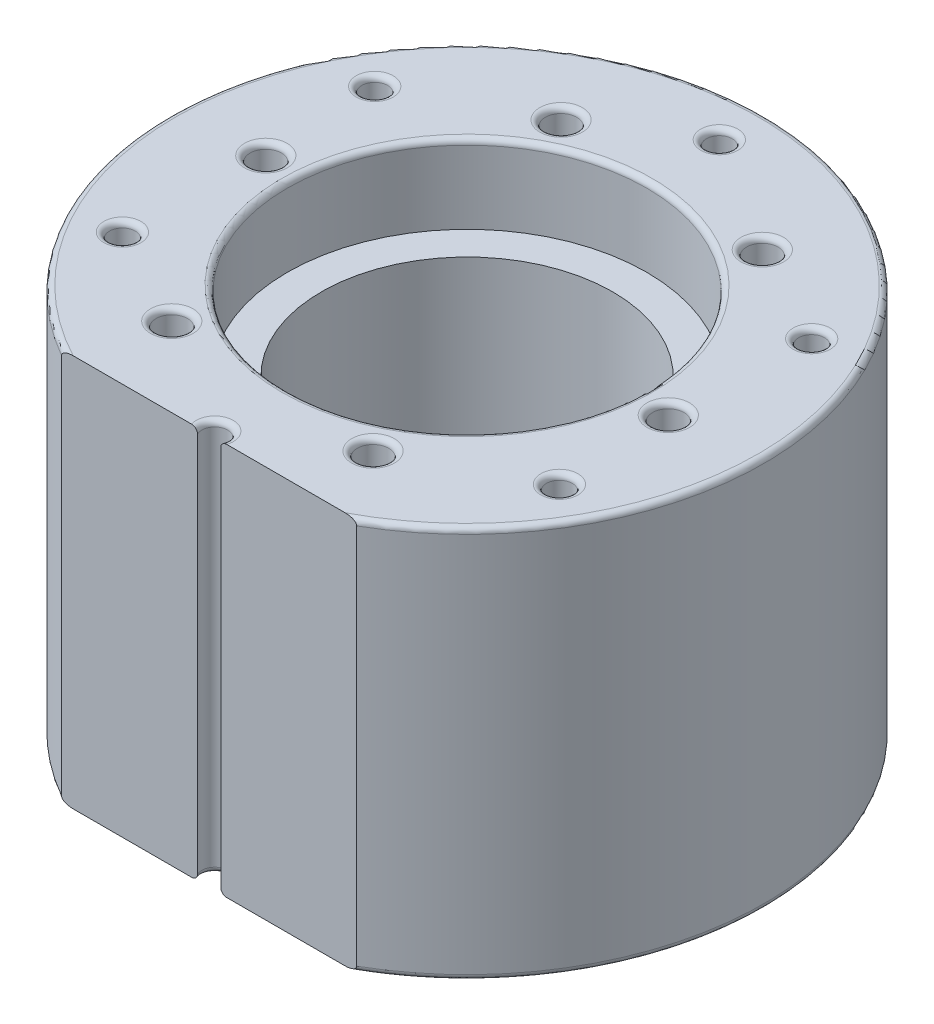
from build123d import *

# Parameters (mm, degrees)
SKETCH2_R          = 1.4
CUT_EXTRUDE1_DEPTH = 20
SKETCH4_R          = 1.15
CUT_EXTRUDE2_DEPTH = 52.278650528
FILLET1_R          = 0.5
SKETCH6_W          = 121.102594462
SKETCH6_H          = 9.633160923
CUT_EXTRUDE3_DEPTH = 52.278650528


with BuildPart() as part:
    # Sketch1 → Revolve1 (revolve)
    with BuildSketch(Plane.XY, mode=Mode.PRIVATE) as revolve1_sk:
        Polygon((16.025, 35), (26.5, 35), (26.5, 0), (13, 0), (13, 28), (16.025, 28), align=None)
    revolve(revolve1_sk.sketch.rotate(Axis((0, 0, 0), (0, 1, 0)), 90), axis=Axis((0, 0, 0), (0, 1, 0)))

    # Sketch2 → Cut-Extrude1 (cut)
    with BuildSketch(Plane(origin=(0, 35, 0), x_dir=(1, 0, 0), z_dir=(0, 1, 0))):
        with Locations(Location((-8.590503645, 16.975095644, 0), (0, 0, 270))):
            Circle(SKETCH2_R)
        with Locations(Location((10.405612237, 15.92714221, 0), (0, 0, 270))):
            Circle(SKETCH2_R)
        with Locations(Location((18.996115882, -1.047953434, 0), (0, 0, 270))):
            Circle(SKETCH2_R)
        with Locations(Location((8.590503645, -16.975095644, 0), (0, 0, 270))):
            Circle(SKETCH2_R)
        with Locations(Location((-10.405612237, -15.92714221, 0), (0, 0, 270))):
            Circle(SKETCH2_R)
        with Locations(Location((-18.996115882, 1.047953434, 0), (0, 0, 270))):
            Circle(SKETCH2_R)
    extrude(amount=-CUT_EXTRUDE1_DEPTH, mode=Mode.SUBTRACT)

    # Sketch4 → Cut-Extrude2 (cut, through all)
    with BuildSketch(Plane.XZ):
        with Locations(Location((0, 22.5, 0), (0, 0, 270))):
            Circle(SKETCH4_R)
        with Locations(Location((19.485571585, 11.25, 0), (0, 0, 270))):
            Circle(SKETCH4_R)
        with Locations(Location((19.485571585, -11.25, 0), (0, 0, 270))):
            Circle(SKETCH4_R)
        with Locations(Location((0, -22.5, 0), (0, 0, 270))):
            Circle(SKETCH4_R)
        with Locations(Location((-19.485571585, -11.25, 0), (0, 0, 270))):
            Circle(SKETCH4_R)
        with Locations(Location((-19.485571585, 11.25, 0), (0, 0, 270))):
            Circle(SKETCH4_R)
    extrude(amount=-CUT_EXTRUDE2_DEPTH, mode=Mode.SUBTRACT)

    # Fillet1
    fillet1_edges = [part.edges().sort_by_distance(p)[0] for p in [
        (-18.996115882, 35, -2.447953434),
        (-10.405612237, 35, 14.52714221),
        (8.590503645, 35, 15.575095644),
        (18.996115882, 35, -0.352046566),
        (10.405612237, 35, -17.32714221),
        (-8.590503645, 35, -18.375095644),
        (0, 35, 23.65),
        (0, 0, 23.65),
        (-19.485571585, 35, 12.4),
        (-19.485571585, 0, 12.4),
        (-19.485571585, 35, -10.1),
        (-19.485571585, 0, -10.1),
        (0, 35, -21.35),
        (0, 0, -21.35),
        (19.485571585, 35, -10.1),
        (19.485571585, 0, -10.1),
        (19.485571585, 35, 12.4),
        (19.485571585, 0, 12.4),
        (0, 0, 13),
        (0, 0, 26.5),
        (0, 35, 26.5),
        (0, 35, 16.025),
    ]]
    fillet(fillet1_edges, radius=FILLET1_R)

    # Sketch6 → Cut-Extrude3 (cut, through all)
    with BuildSketch(Plane(origin=(0, 35, 0), x_dir=(1, 0, 0), z_dir=(0, 1, 0))):
        with Locations((0.779827313, -27.816580462)):
            Rectangle(SKETCH6_W, SKETCH6_H)
    extrude(amount=-CUT_EXTRUDE3_DEPTH, mode=Mode.SUBTRACT)


solid = part.part
